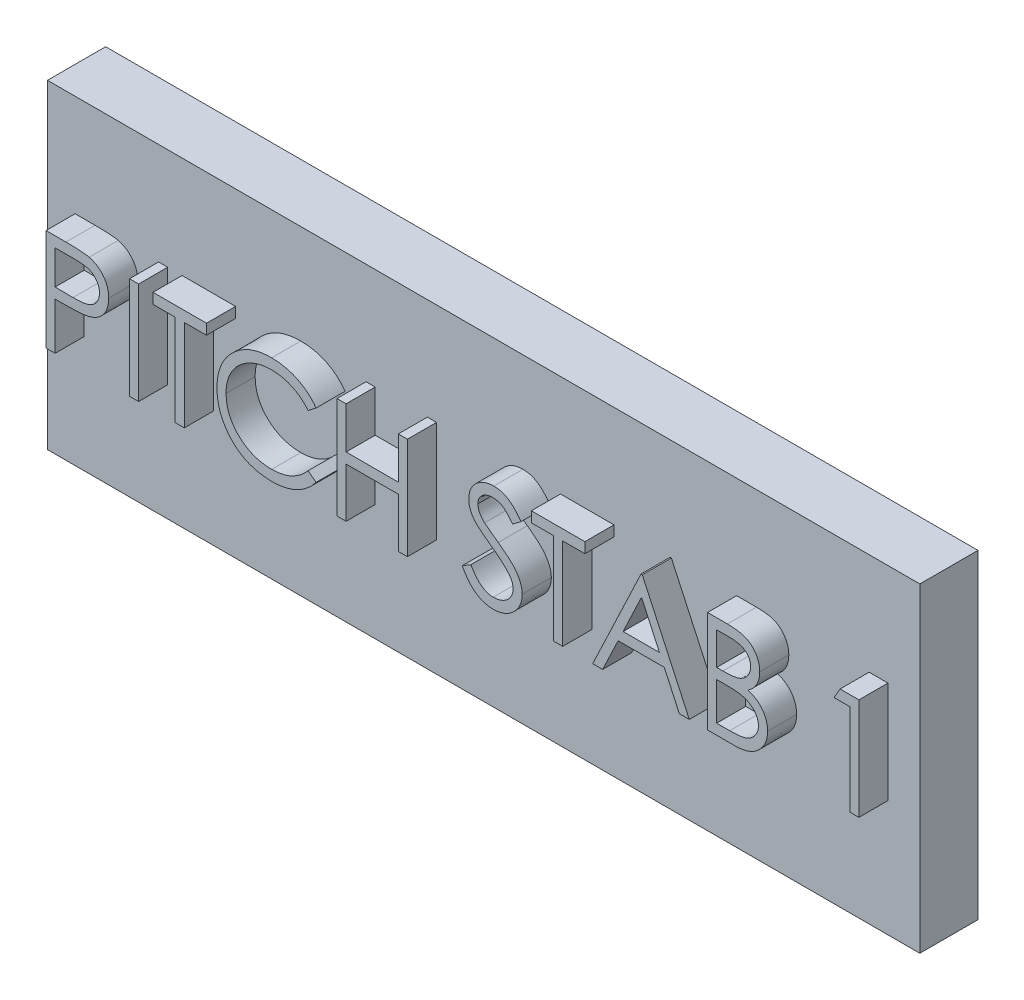
from build123d import *

# Parameters (mm, degrees)
SKETCH1_W           = 30
SKETCH1_H           = 11
BOSS_EXTRUDE1_DEPTH = 2
SKETCH2_W           = 0.314102564
SKETCH2_H           = 3.5
BOSS_EXTRUDE2_DEPTH = 1


with BuildPart() as part:
    # Sketch1 → Boss-Extrude1 (new body)
    with BuildSketch(Plane.XY):
        with Locations((-36.24, 26.08)):
            Rectangle(SKETCH1_W, SKETCH1_H)
    extrude(amount=BOSS_EXTRUDE1_DEPTH)

    # Sketch2 → Boss-Extrude2 (add)
    # profile 1 of 10: a face of its own
    with BuildSketch(Plane.XY.offset(2)):
        with BuildLine():
            Line((-50.291282051, 28.08), (-49.604883814, 28.08))
            add(Edge.make_bspline(
                [(-49.604883814, 28.08), (-49.557672908, 28.079948104), (-49.467214715, 28.079848668), (-49.337499659, 28.076833922), (-49.219689928, 28.07280723), (-49.114039547, 28.067225337), (-49.020223449, 28.060628747), (-48.938666149, 28.051376708), (-48.868726593, 28.041716412), (-48.826820143, 28.031895005), (-48.807708333, 28.027415865)],
                knots=[0, 0, 0, 0, 1.415646017, 2.712440637, 3.8905458, 4.950247383, 5.884950622, 6.709939814, 7.411656543, 8, 8, 8, 8], degree=3))
            add(Edge.make_bspline(
                [(-48.807708333, 28.027415865), (-48.7835148, 28.020793916), (-48.735697822, 28.007706054), (-48.666796779, 27.98149233), (-48.601242934, 27.950410165), (-48.538811375, 27.914986225), (-48.480269292, 27.873700661), (-48.424743251, 27.828227043), (-48.372723271, 27.777515475), (-48.324501879, 27.722134735), (-48.280217082, 27.663014525), (-48.242087399, 27.599272295), (-48.210160172, 27.531980992), (-48.1827769, 27.461187421), (-48.163068446, 27.386297097), (-48.148221546, 27.307830385), (-48.138797918, 27.225795695), (-48.137895357, 27.169735827), (-48.137435897, 27.141197917)],
                knots=[0, 0, 0, 0, 0.999701418, 1.975846123, 2.934577507, 3.890451536, 4.834027766, 5.787354733, 6.749476667, 7.726910423, 8.712836071, 9.690891519, 10.682875813, 11.679750201, 12.712814741, 13.765529915, 14.8625177, 16, 16, 16, 16], degree=3))
            add(Edge.make_bspline(
                [(-48.137435897, 27.141197917), (-48.137857322, 27.11242014), (-48.138681868, 27.056114476), (-48.148578153, 26.973741688), (-48.161908345, 26.895023298), (-48.182405397, 26.820133847), (-48.20925107, 26.749518077), (-48.240743123, 26.682096845), (-48.278726654, 26.619017173), (-48.322371483, 26.560050055), (-48.370923078, 26.505140143), (-48.424176016, 26.454685348), (-48.481915308, 26.40898101), (-48.543957457, 26.367924666), (-48.610907305, 26.332468387), (-48.681749459, 26.300711082), (-48.757099675, 26.274040021), (-48.809242189, 26.26000996), (-48.835753205, 26.252876603)],
                knots=[0, 0, 0, 0, 1.121902311, 2.195077645, 3.232258892, 4.234102512, 5.217864754, 6.176164875, 7.132989551, 8.084763148, 9.034132444, 9.988522005, 10.94243251, 11.903244335, 12.886203696, 13.894208494, 14.929344452, 16, 16, 16, 16], degree=3))
            add(Edge.make_bspline(
                [(-48.835753205, 26.252876603), (-48.857680539, 26.248213621), (-48.905735566, 26.237994427), (-48.984878289, 26.22658597), (-49.077023675, 26.21684837), (-49.182045955, 26.209547232), (-49.299850859, 26.203296864), (-49.430502117, 26.19832877), (-49.574256194, 26.195598916), (-49.674527438, 26.195458123), (-49.726879006, 26.195384615)],
                knots=[0, 0, 0, 0, 0.601384939, 1.31797006, 2.144135048, 3.087295005, 4.142315834, 5.309527816, 6.595305764, 8, 8, 8, 8], degree=3))
            Line((-49.726879006, 26.195384615), (-49.977179487, 26.195384615))
            Line((-49.977179487, 26.195384615), (-49.977179487, 24.58))
            Line((-49.977179487, 24.58), (-50.291282051, 24.58))
            Line((-50.291282051, 24.58), (-50.291282051, 28.08))
        make_face()
        with BuildLine():
            Line((-49.977179487, 27.721025641), (-49.977179487, 26.554358974))
            Line((-49.977179487, 26.554358974), (-49.364399038, 26.546646635))
            add(Edge.make_bspline(
                [(-49.364399038, 26.546646635), (-49.334479113, 26.546631171), (-49.276719313, 26.546601319), (-49.193283089, 26.550586542), (-49.115873802, 26.555187075), (-49.044729227, 26.561922998), (-48.979817292, 26.571444256), (-48.921029763, 26.581055994), (-48.868822481, 26.594961356), (-48.807723279, 26.613684426), (-48.739639931, 26.645617041), (-48.665572383, 26.691966931), (-48.602801796, 26.75104764), (-48.5484835, 26.817475471), (-48.505377622, 26.8913746), (-48.473821629, 26.970443537), (-48.455280472, 27.053871387), (-48.452794278, 27.110959525), (-48.451538462, 27.139795673)],
                knots=[0, 0, 0, 0, 1.160613943, 2.240541288, 3.23993089, 4.169200891, 5.011653406, 5.7853311, 6.478053781, 7.106038997, 8.262395093, 9.384106736, 10.481365981, 11.59014053, 12.70357646, 13.786202915, 14.881775077, 16, 16, 16, 16], degree=3))
            add(Edge.make_bspline(
                [(-48.451538462, 27.139795673), (-48.452801108, 27.167934187), (-48.455311093, 27.223870069), (-48.473966956, 27.305848829), (-48.50531627, 27.384084534), (-48.548772865, 27.457057619), (-48.601513994, 27.523246423), (-48.662813338, 27.58074355), (-48.732526599, 27.626965253), (-48.79737483, 27.656798534), (-48.854976016, 27.67501381), (-48.905007976, 27.68775865), (-48.96149865, 27.697934257), (-49.02446643, 27.706173759), (-49.093423264, 27.713227221), (-49.168961579, 27.718013198), (-49.250795222, 27.720814654), (-49.307605793, 27.720953609), (-49.337055288, 27.721025641)],
                knots=[0, 0, 0, 0, 1.120700087, 2.227813068, 3.331159281, 4.466773991, 5.599788987, 6.693661531, 7.80175334, 8.91857717, 9.525282508, 10.207424825, 10.974604443, 11.810962634, 12.737642355, 13.736264703, 14.826523623, 16, 16, 16, 16], degree=3))
            Line((-49.337055288, 27.721025641), (-49.977179487, 27.721025641))
        make_face(mode=Mode.SUBTRACT)
    # profile 2 of 10: a face of its own
    with BuildSketch(Plane.XY.offset(2)):
        with Locations((-47.262435897, 26.33)):
            Rectangle(SKETCH2_W, SKETCH2_H)
    # profile 3 of 10: a face of its own
    with BuildSketch(Plane.XY.offset(2)):
        Polygon((-46.611794872, 27.721025641), (-46.611794872, 28.08), (-44.772051282, 28.08), (-44.772051282, 27.721025641), (-45.534871795, 27.721025641), (-45.534871795, 24.58), (-45.848974359, 24.58), (-45.848974359, 27.721025641), align=None)
    # profile 4 of 10: a face of its own
    with BuildSketch(Plane.XY.offset(2)):
        with BuildLine():
            Line((-41.002820513, 27.437772436), (-41.277660256, 27.227435897))
            add(Edge.make_bspline(
                [(-41.277660256, 27.227435897), (-41.297266145, 27.250801867), (-41.336213592, 27.297218783), (-41.398872794, 27.362398327), (-41.464174437, 27.423463589), (-41.532093558, 27.480705469), (-41.603852678, 27.532122234), (-41.677713476, 27.580393337), (-41.754911522, 27.623661075), (-41.861663256, 27.676124061), (-42.001311105, 27.730870216), (-42.177105944, 27.776773448), (-42.360617042, 27.805994623), (-42.485814642, 27.809159465), (-42.549495192, 27.810769231)],
                knots=[0, 0, 0, 0, 0.757959112, 1.505699292, 2.245454638, 2.979532153, 3.711538275, 4.438200793, 5.171680507, 5.909471876, 7.393775596, 8.890124382, 10.418191784, 12, 12, 12, 12], degree=3))
            add(Edge.make_bspline(
                [(-42.549495192, 27.810769231), (-42.584578492, 27.810365268), (-42.654419484, 27.809561092), (-42.758067958, 27.798951967), (-42.859781009, 27.784040757), (-42.959492475, 27.761915434), (-43.057075434, 27.733942815), (-43.153167836, 27.700517401), (-43.246378435, 27.659162561), (-43.337996674, 27.613454301), (-43.425775885, 27.561826856), (-43.508830932, 27.505513504), (-43.5868589, 27.445144408), (-43.659921513, 27.380493302), (-43.728093461, 27.311851341), (-43.790880772, 27.238487), (-43.848066182, 27.160634826), (-43.900783207, 27.079321419), (-43.94799594, 26.994783627), (-43.98752582, 26.906708556), (-44.022530942, 26.816604453), (-44.050230185, 26.723453293), (-44.072154701, 26.627910527), (-44.087282365, 26.529719739), (-44.097770836, 26.429086059), (-44.098571013, 26.360876747), (-44.098974359, 26.326494391)],
                knots=[0, 0, 0, 0, 1.054917814, 2.100044995, 3.131103042, 4.146048494, 5.169673617, 6.183595914, 7.203665975, 8.234915748, 9.262203917, 10.264457458, 11.251630812, 12.227803204, 13.197192746, 14.159520551, 15.12972552, 16.100847026, 17.073214652, 18.039054194, 19.002613845, 19.979014051, 20.95965708, 21.949030935, 22.966165397, 24, 24, 24, 24], degree=3))
            add(Edge.make_bspline(
                [(-44.098974359, 26.326494391), (-44.09771254, 26.274763071), (-44.095235126, 26.173195486), (-44.073186792, 26.024424876), (-44.0396817, 25.881904202), (-43.989466123, 25.74652436), (-43.927547073, 25.616616002), (-43.849306461, 25.494377148), (-43.758689924, 25.377960584), (-43.654415504, 25.270117636), (-43.540009688, 25.171603911), (-43.417261777, 25.084853329), (-43.286477489, 25.012538447), (-43.149100859, 24.9523625), (-43.004074745, 24.906105772), (-42.851659943, 24.873541649), (-42.692187947, 24.852299468), (-42.583218547, 24.85026578), (-42.527760417, 24.849230769)],
                knots=[0, 0, 0, 0, 1.029171465, 2.020641659, 2.987623507, 3.938342917, 4.889210282, 5.84687017, 6.821220943, 7.821438502, 8.827599549, 9.822697543, 10.807740252, 11.797342354, 12.80366471, 13.83203677, 14.896651826, 16, 16, 16, 16], degree=3))
            add(Edge.make_bspline(
                [(-42.527760417, 24.849230769), (-42.466657728, 24.850919549), (-42.346393019, 24.854243472), (-42.170024992, 24.882402721), (-42.001189227, 24.928060638), (-41.83987664, 24.991958561), (-41.686541994, 25.075023849), (-41.540945334, 25.175721726), (-41.402963763, 25.295010059), (-41.319992481, 25.386093187), (-41.277660256, 25.432564103)],
                knots=[0, 0, 0, 0, 1.028121516, 2.023589091, 2.998037872, 3.967518031, 4.937445131, 5.927275754, 6.942489185, 8, 8, 8, 8], degree=3))
            Line((-41.277660256, 25.432564103), (-41.002820513, 25.224330929))
            add(Edge.make_bspline(
                [(-41.002820513, 25.224330929), (-41.024938623, 25.195792478), (-41.069068898, 25.138852271), (-41.140526915, 25.058580562), (-41.215804212, 24.983076526), (-41.295459922, 24.912948905), (-41.378577714, 24.846794439), (-41.466650026, 24.786492608), (-41.558519059, 24.731201724), (-41.653873538, 24.680574799), (-41.752612151, 24.635657552), (-41.854616585, 24.597203784), (-41.959447161, 24.564078895), (-42.067108669, 24.536826958), (-42.177824426, 24.515555874), (-42.2911949, 24.501336199), (-42.407464775, 24.491594285), (-42.485906197, 24.490706369), (-42.525657051, 24.49025641)],
                knots=[0, 0, 0, 0, 0.986787822, 1.968848986, 2.935600012, 3.899624008, 4.868462664, 5.837806735, 6.815139263, 7.798259679, 8.787526145, 9.778297419, 10.776456485, 11.791383307, 12.812564526, 13.85620153, 14.913611965, 16, 16, 16, 16], degree=3))
            add(Edge.make_bspline(
                [(-42.525657051, 24.49025641), (-42.563300718, 24.490518403), (-42.637736408, 24.491036461), (-42.74763516, 24.499428628), (-42.854624741, 24.510878365), (-42.958399367, 24.528118496), (-43.059525342, 24.548462836), (-43.157085926, 24.575734093), (-43.252041137, 24.606283259), (-43.344009477, 24.642188246), (-43.433069177, 24.682704429), (-43.518932988, 24.728495987), (-43.601561421, 24.779177852), (-43.681766842, 24.833632863), (-43.758364425, 24.893610164), (-43.832017951, 24.958276799), (-43.903140427, 25.02741481), (-43.947143112, 25.077269663), (-43.969266827, 25.102335737)],
                knots=[0, 0, 0, 0, 1.114604814, 2.203992996, 3.262667896, 4.300477797, 5.318619304, 6.316056647, 7.298880507, 8.271930387, 9.238335007, 10.195173496, 11.151986948, 12.108099108, 13.064862484, 14.031167946, 15.010108607, 16, 16, 16, 16], degree=3))
            add(Edge.make_bspline(
                [(-43.969266827, 25.102335737), (-44.00470247, 25.145876926), (-44.075145947, 25.232433637), (-44.165271631, 25.372719618), (-44.242419186, 25.519187827), (-44.304795107, 25.672607755), (-44.35355784, 25.832635143), (-44.387339035, 25.999350657), (-44.40929064, 26.172598599), (-44.411800928, 26.290435388), (-44.413076923, 26.350332532)],
                knots=[0, 0, 0, 0, 0.994628077, 1.977248131, 2.950237994, 3.925870899, 4.908910175, 5.911660606, 6.938484602, 8, 8, 8, 8], degree=3))
            add(Edge.make_bspline(
                [(-44.413076923, 26.350332532), (-44.41152173, 26.413287986), (-44.408461983, 26.53714891), (-44.382466188, 26.718922863), (-44.340647392, 26.893074262), (-44.281250503, 27.059278007), (-44.205945152, 27.218408287), (-44.112918538, 27.369249492), (-44.003251396, 27.512766292), (-43.877803828, 27.646781043), (-43.740236493, 27.769320396), (-43.592917679, 27.877126599), (-43.436135732, 27.966844115), (-43.27161788, 28.041840278), (-43.098132199, 28.099484741), (-42.916048829, 28.139837928), (-42.725709915, 28.164955044), (-42.595847489, 28.168130252), (-42.529863782, 28.16974359)],
                knots=[0, 0, 0, 0, 1.032925535, 2.032216505, 3.007276963, 3.968222605, 4.92396291, 5.891752235, 6.871517503, 7.883894988, 8.900124299, 9.891468569, 10.874487609, 11.85992873, 12.854644235, 13.869047385, 14.917252991, 16, 16, 16, 16], degree=3))
            add(Edge.make_bspline(
                [(-42.529863782, 28.16974359), (-42.48964931, 28.169261452), (-42.410048813, 28.168307108), (-42.29229616, 28.159000965), (-42.177653833, 28.143487359), (-42.066042851, 28.122371289), (-41.956920235, 28.096163968), (-41.851119994, 28.06202367), (-41.748021307, 28.022987138), (-41.648274399, 27.978028672), (-41.552357849, 27.927561931), (-41.460301531, 27.872146307), (-41.372836672, 27.811850502), (-41.289347824, 27.747187326), (-41.211231612, 27.676788767), (-41.136270134, 27.602591171), (-41.067009056, 27.522457347), (-41.024255861, 27.466052413), (-41.002820513, 27.437772436)],
                knots=[0, 0, 0, 0, 1.096760587, 2.17092713, 3.219439832, 4.250915756, 5.268269357, 6.278326846, 7.281116186, 8.274029601, 9.260640565, 10.235837813, 11.203064059, 12.156899882, 13.114053108, 14.069676657, 15.032185724, 16, 16, 16, 16], degree=3))
        make_face()
    # profile 5 of 10: a face of its own
    with BuildSketch(Plane.XY.offset(2)):
        Polygon((-40.284871795, 28.08), (-39.970769231, 28.08), (-39.970769231, 26.644102564), (-38.175897436, 26.644102564), (-38.175897436, 28.08), (-37.861794872, 28.08), (-37.861794872, 24.58), (-38.175897436, 24.58), (-38.175897436, 26.285128205), (-39.970769231, 26.285128205), (-39.970769231, 24.58), (-40.284871795, 24.58), align=None)
    # profile 6 of 10: a face of its own
    with BuildSketch(Plane.XY.offset(2)):
        with BuildLine():
            Line((-35.977179487, 25.255180288), (-35.68130609, 25.432564103))
            add(Edge.make_bspline(
                [(-35.68130609, 25.432564103), (-35.653787852, 25.386499718), (-35.601063972, 25.298242134), (-35.513112613, 25.178984093), (-35.421979702, 25.077621937), (-35.326990368, 24.994745329), (-35.22872442, 24.929496442), (-35.126540366, 24.883294211), (-35.020782555, 24.854478235), (-34.948808734, 24.850978149), (-34.912876603, 24.849230769)],
                knots=[0, 0, 0, 0, 1.272034388, 2.437168799, 3.508375237, 4.49857839, 5.41946034, 6.295179144, 7.148887113, 8, 8, 8, 8], degree=3))
            add(Edge.make_bspline(
                [(-34.912876603, 24.849230769), (-34.882189742, 24.850085442), (-34.821352969, 24.851779832), (-34.731790726, 24.868060634), (-34.644808924, 24.893072763), (-34.562200286, 24.928893694), (-34.485104672, 24.97223218), (-34.417497976, 25.024578358), (-34.359051863, 25.083184563), (-34.311242748, 25.148567218), (-34.274562713, 25.218884367), (-34.246370645, 25.291060318), (-34.230725571, 25.366228886), (-34.228368818, 25.416839349), (-34.227179487, 25.442379808)],
                knots=[0, 0, 0, 0, 1.095163259, 2.171163733, 3.241058638, 4.321873601, 5.38011039, 6.391990106, 7.366004449, 8.327778327, 9.272591725, 10.192022065, 11.087607919, 12, 12, 12, 12], degree=3))
            add(Edge.make_bspline(
                [(-34.227179487, 25.442379808), (-34.228653798, 25.471520657), (-34.231650856, 25.530759747), (-34.256982336, 25.6181594), (-34.296831583, 25.70465197), (-34.333594227, 25.758153235), (-34.352680288, 25.785929487)],
                knots=[0, 0, 0, 0, 0.938893495, 1.908633276, 2.914225137, 4, 4, 4, 4], degree=3))
            add(Edge.make_bspline(
                [(-34.352680288, 25.785929487), (-34.368350903, 25.805976311), (-34.401249397, 25.848062109), (-34.45780691, 25.910707345), (-34.524173024, 25.975325764), (-34.598076579, 26.044384821), (-34.682209668, 26.114672617), (-34.773937182, 26.189540895), (-34.875601041, 26.266142472), (-34.946900538, 26.317515038), (-34.983689904, 26.344022436)],
                knots=[0, 0, 0, 0, 0.722233717, 1.516239348, 2.393582979, 3.351407094, 4.387010283, 5.505090956, 6.712668013, 8, 8, 8, 8], degree=3))
            add(Edge.make_bspline(
                [(-34.983689904, 26.344022436), (-35.0205139, 26.370251024), (-35.090918577, 26.420398086), (-35.189377159, 26.49482237), (-35.277421622, 26.562866239), (-35.354660638, 26.625170251), (-35.421060235, 26.681742856), (-35.477143646, 26.732040795), (-35.521482203, 26.777424356), (-35.546137784, 26.806865698), (-35.557207532, 26.820084135)],
                knots=[0, 0, 0, 0, 1.452282411, 2.77665338, 3.964542531, 5.026858415, 5.96415736, 6.766646006, 7.446254459, 8, 8, 8, 8], degree=3))
            add(Edge.make_bspline(
                [(-35.557207532, 26.820084135), (-35.572680077, 26.840685171), (-35.603108914, 26.881199875), (-35.643274919, 26.944524733), (-35.677414082, 27.009347998), (-35.704176414, 27.075843863), (-35.726712633, 27.143078792), (-35.741870564, 27.211930038), (-35.751361961, 27.282088656), (-35.752333947, 27.329302157), (-35.752820513, 27.352936699)],
                knots=[0, 0, 0, 0, 1.068054152, 2.10047183, 3.106115577, 4.101338837, 5.06977816, 6.043150881, 7.020423561, 8, 8, 8, 8], degree=3))
            add(Edge.make_bspline(
                [(-35.752820513, 27.352936699), (-35.751515304, 27.389966473), (-35.748932784, 27.463234537), (-35.727092266, 27.570265367), (-35.692619373, 27.672451785), (-35.644324485, 27.768782118), (-35.582067132, 27.856748099), (-35.510021158, 27.937361586), (-35.424209671, 28.005130168), (-35.330057048, 28.064342227), (-35.227000676, 28.110688152), (-35.119009773, 28.145649132), (-35.005912701, 28.16545839), (-34.929309566, 28.168301155), (-34.890440705, 28.16974359)],
                knots=[0, 0, 0, 0, 1.005424448, 1.989358655, 2.955360095, 3.929531133, 4.905563448, 5.876582895, 6.856512386, 7.866279853, 8.892233794, 9.918561126, 10.94386622, 12, 12, 12, 12], degree=3))
            add(Edge.make_bspline(
                [(-34.890440705, 28.16974359), (-34.849196605, 28.168321038), (-34.767175253, 28.165492037), (-34.646526038, 28.140894506), (-34.530365321, 28.100193834), (-34.436922056, 28.054005176), (-34.363789295, 28.00787376), (-34.308016562, 27.965853936), (-34.251499111, 27.917478827), (-34.193781057, 27.862619581), (-34.135840397, 27.80077283), (-34.076816945, 27.732362141), (-34.016572676, 27.657805585), (-33.977816816, 27.604581085), (-33.957948718, 27.577295673)],
                knots=[0, 0, 0, 0, 1.286793592, 2.559021753, 3.825965368, 5.121522368, 5.803751409, 6.523245864, 7.299691795, 8.125521123, 9.008227632, 9.944561021, 10.946284179, 12, 12, 12, 12], degree=3))
            Line((-33.957948718, 27.577295673), (-34.241903045, 27.362051282))
            add(Edge.make_bspline(
                [(-34.241903045, 27.362051282), (-34.259048977, 27.384139972), (-34.292068034, 27.426677626), (-34.342197521, 27.486248941), (-34.389446169, 27.540665421), (-34.435996569, 27.587930549), (-34.4793902, 27.630632682), (-34.521507243, 27.667192439), (-34.561741594, 27.697968034), (-34.612458505, 27.730811594), (-34.676176223, 27.763368098), (-34.756160759, 27.790917176), (-34.839747034, 27.807472238), (-34.896676666, 27.809661126), (-34.925496795, 27.810769231)],
                knots=[0, 0, 0, 0, 1.181633172, 2.275549214, 3.290209073, 4.226197932, 5.078386478, 5.862611352, 6.581680152, 7.217281963, 8.414376989, 9.595101626, 10.782541182, 12, 12, 12, 12], degree=3))
            add(Edge.make_bspline(
                [(-34.925496795, 27.810769231), (-34.961653317, 27.809557531), (-35.031377765, 27.807220882), (-35.130368001, 27.781700896), (-35.219461926, 27.741519036), (-35.296014491, 27.685204058), (-35.359751468, 27.618483065), (-35.405856927, 27.54170421), (-35.433607091, 27.456921808), (-35.436993371, 27.397780151), (-35.438717949, 27.367660256)],
                knots=[0, 0, 0, 0, 1.14458467, 2.207223713, 3.21896685, 4.227309161, 5.202851033, 6.127160689, 7.046193047, 8, 8, 8, 8], degree=3))
            add(Edge.make_bspline(
                [(-35.438717949, 27.367660256), (-35.438324822, 27.348908778), (-35.437537926, 27.311375158), (-35.426563128, 27.255923736), (-35.412463799, 27.200612397), (-35.390121168, 27.145689814), (-35.359275864, 27.090195455), (-35.318770688, 27.033173718), (-35.267757376, 26.974122009), (-35.228680364, 26.935714635), (-35.208048878, 26.915436699)],
                knots=[0, 0, 0, 0, 0.858281714, 1.717966888, 2.583508476, 3.4729293, 4.427298488, 5.488583878, 6.674047936, 8, 8, 8, 8], degree=3))
            add(Edge.make_bspline(
                [(-35.208048878, 26.915436699), (-35.200387506, 26.908599673), (-35.182185839, 26.892356465), (-35.148909913, 26.865764184), (-35.104967115, 26.832961412), (-35.051504914, 26.792374095), (-34.987537552, 26.745292633), (-34.913057996, 26.692319021), (-34.828896463, 26.631733562), (-34.769174547, 26.589376021), (-34.737596154, 26.566979167)],
                knots=[0, 0, 0, 0, 0.420754252, 0.999615792, 1.744751191, 2.668019286, 3.750313428, 4.999500688, 6.413464383, 8, 8, 8, 8], degree=3))
            add(Edge.make_bspline(
                [(-34.737596154, 26.566979167), (-34.699610241, 26.539337807), (-34.626055784, 26.485814145), (-34.521398204, 26.405398465), (-34.426504396, 26.326750697), (-34.341041193, 26.25037309), (-34.264164284, 26.176844997), (-34.196726563, 26.105281816), (-34.138040883, 26.036196244), (-34.074861665, 25.947623668), (-34.010303845, 25.838842584), (-33.954862338, 25.705564345), (-33.91990399, 25.571768025), (-33.915332475, 25.481841188), (-33.913076923, 25.437471955)],
                knots=[0, 0, 0, 0, 1.163667725, 2.253281268, 3.268753668, 4.215851969, 5.092017293, 5.902905408, 6.650798638, 7.335211899, 8.59617414, 9.77448103, 10.901945474, 12, 12, 12, 12], degree=3))
            add(Edge.make_bspline(
                [(-33.913076923, 25.437471955), (-33.913734061, 25.40609359), (-33.915035576, 25.343946206), (-33.92999649, 25.25269113), (-33.951916155, 25.16406026), (-33.984953389, 25.079149147), (-34.025276547, 24.996404385), (-34.076442795, 24.917996484), (-34.13575048, 24.842190086), (-34.203784245, 24.771006594), (-34.278230147, 24.705660398), (-34.356913842, 24.647531337), (-34.439964115, 24.599063014), (-34.526930432, 24.559512172), (-34.617832768, 24.528578654), (-34.712640552, 24.506165785), (-34.811510063, 24.492410074), (-34.878710545, 24.490982313), (-34.912876603, 24.49025641)],
                knots=[0, 0, 0, 0, 0.983748083, 1.948392443, 2.894712957, 3.844097841, 4.80183111, 5.778335162, 6.776009319, 7.81870978, 8.863265674, 9.881300176, 10.883814829, 11.87499822, 12.874611388, 13.892143829, 14.928324115, 16, 16, 16, 16], degree=3))
            add(Edge.make_bspline(
                [(-34.912876603, 24.49025641), (-34.939311946, 24.490767592), (-34.991849706, 24.491783517), (-35.069559187, 24.500764798), (-35.145698777, 24.513471901), (-35.219313059, 24.533645971), (-35.29135047, 24.558122948), (-35.361497705, 24.588261281), (-35.429788759, 24.624378482), (-35.496606342, 24.665673507), (-35.561780516, 24.713731252), (-35.624699984, 24.769704748), (-35.68742917, 24.832050253), (-35.748116566, 24.902460816), (-35.80798971, 24.979798899), (-35.86586812, 25.064788083), (-35.922949837, 25.156965436), (-35.958765305, 25.221830522), (-35.977179487, 25.255180288)],
                knots=[0, 0, 0, 0, 0.915332311, 1.819136955, 2.706846663, 3.586547465, 4.459518054, 5.340707479, 6.227863349, 7.133153174, 8.059268498, 9.028702269, 10.047606654, 11.120612155, 12.245963614, 13.433783089, 14.680604001, 16, 16, 16, 16], degree=3))
        make_face()
    # profile 7 of 10: a face of its own
    with BuildSketch(Plane.XY.offset(2)):
        Polygon((-33.598974359, 27.721025641), (-33.598974359, 28.08), (-31.759230769, 28.08), (-31.759230769, 27.721025641), (-32.522051282, 27.721025641), (-32.522051282, 24.58), (-32.836153846, 24.58), (-32.836153846, 27.721025641), align=None)
    # profile 8 of 10: a face of its own
    with BuildSketch(Plane.XY.offset(2)):
        Polygon((-29.784871795, 28.08), (-28.169487179, 24.58), (-28.510933494, 24.58), (-29.028361378, 25.701794872), (-30.615, 25.701794872), (-31.147151442, 24.58), (-31.49, 24.58), (-29.82974359, 28.08), align=None)
        Polygon((-29.810813301, 27.397808494), (-30.444627404, 26.060769231), (-29.193826122, 26.060769231), align=None, mode=Mode.SUBTRACT)
    # profile 9 of 10: a face of its own
    with BuildSketch(Plane.XY.offset(2)):
        with BuildLine():
            Line((-27.541282051, 28.08), (-26.858389423, 28.08))
            add(Edge.make_bspline(
                [(-26.858389423, 28.08), (-26.824960945, 28.07982425), (-26.760168235, 28.079483602), (-26.665948793, 28.07420047), (-26.577699982, 28.066996801), (-26.49539621, 28.055566708), (-26.419075507, 28.041774931), (-26.34850787, 28.025073115), (-26.283917698, 28.005046501), (-26.206804961, 27.97320022), (-26.118884301, 27.925877051), (-26.023685908, 27.855948486), (-25.942281668, 27.770416023), (-25.872095351, 27.673933368), (-25.816294232, 27.567797596), (-25.775924934, 27.454538407), (-25.750367059, 27.335616665), (-25.747738625, 27.253973487), (-25.746410256, 27.21271234)],
                knots=[0, 0, 0, 0, 1.001505555, 1.941167018, 2.826882275, 3.653841531, 4.429895133, 5.150066043, 5.825578002, 6.45369114, 7.647487171, 8.808567382, 9.977351308, 11.170798116, 12.373658725, 13.556498008, 14.765093433, 16, 16, 16, 16], degree=3))
            add(Edge.make_bspline(
                [(-25.746410256, 27.21271234), (-25.747503475, 27.174059784), (-25.749651752, 27.098103867), (-25.770194512, 26.987009758), (-25.80235518, 26.881258539), (-25.847060429, 26.781236154), (-25.905162425, 26.68920254), (-25.974020744, 26.604415274), (-26.057097546, 26.530464217), (-26.119340786, 26.489121315), (-26.150957532, 26.468120994)],
                knots=[0, 0, 0, 0, 1.044552857, 2.05264487, 3.044412934, 4.028983338, 5.005914585, 5.980388656, 6.974128949, 8, 8, 8, 8], degree=3))
            add(Edge.make_bspline(
                [(-26.150957532, 26.468120994), (-26.111197104, 26.452855995), (-26.035125557, 26.42365027), (-25.930439545, 26.372014806), (-25.8402447, 26.315852696), (-25.763847554, 26.254520846), (-25.698509899, 26.188412035), (-25.641456957, 26.116556921), (-25.592775583, 26.038018163), (-25.551062659, 25.953614627), (-25.518513903, 25.864208159), (-25.494137999, 25.770637383), (-25.48017055, 25.673237828), (-25.478182909, 25.606952448), (-25.477179487, 25.573489583)],
                knots=[0, 0, 0, 0, 1.27268992, 2.434971085, 3.483601985, 4.442670788, 5.356604649, 6.2567628, 7.179492994, 8.113709626, 9.066344395, 10.018646069, 10.999752585, 12, 12, 12, 12], degree=3))
            add(Edge.make_bspline(
                [(-25.477179487, 25.573489583), (-25.478156333, 25.539322711), (-25.480078305, 25.472098433), (-25.494258277, 25.373343299), (-25.518267384, 25.278968352), (-25.55133853, 25.188363169), (-25.594500845, 25.101703035), (-25.647028809, 25.018889771), (-25.709660373, 24.94075544), (-25.779723242, 24.866431817), (-25.858985387, 24.79960403), (-25.944501142, 24.740088323), (-26.037347462, 24.691142261), (-26.135999456, 24.650026239), (-26.241563772, 24.618619041), (-26.35356638, 24.596646467), (-26.471910681, 24.58184143), (-26.553120433, 24.580624225), (-26.594767628, 24.58)],
                knots=[0, 0, 0, 0, 0.978564426, 1.925352924, 2.850884081, 3.763762016, 4.682927383, 5.618979971, 6.567305752, 7.547517671, 8.540179244, 9.531824382, 10.526200242, 11.540722885, 12.589160233, 13.674978461, 14.80764778, 16, 16, 16, 16], degree=3))
            Line((-26.594767628, 24.58), (-27.541282051, 24.58))
            Line((-27.541282051, 24.58), (-27.541282051, 28.08))
        make_face()
        with BuildLine():
            Line((-27.227179487, 27.721025641), (-27.227179487, 26.599230769))
            Line((-27.227179487, 26.599230769), (-27.016141827, 26.599230769))
            add(Edge.make_bspline(
                [(-27.016141827, 26.599230769), (-26.985293032, 26.599630692), (-26.925686872, 26.600403425), (-26.839366976, 26.602616942), (-26.759241958, 26.608814985), (-26.685450124, 26.615011248), (-26.618107681, 26.625085835), (-26.557363819, 26.637077958), (-26.502265222, 26.649760863), (-26.438725677, 26.67133035), (-26.366652728, 26.703208025), (-26.289819624, 26.752679861), (-26.222085154, 26.811604215), (-26.164887967, 26.879595176), (-26.118076496, 26.954461362), (-26.085562781, 27.035008243), (-26.063515497, 27.119228375), (-26.061523965, 27.177046627), (-26.060512821, 27.206402244)],
                knots=[0, 0, 0, 0, 1.156816544, 2.235205308, 3.236616184, 4.169592532, 5.011045266, 5.787822928, 6.49130361, 7.128639758, 8.301311294, 9.436451833, 10.541879658, 11.654887649, 12.756523258, 13.837046038, 14.901820046, 16, 16, 16, 16], degree=3))
            add(Edge.make_bspline(
                [(-26.060512821, 27.206402244), (-26.061039001, 27.225828015), (-26.062071161, 27.263933787), (-26.070524463, 27.319483141), (-26.084892038, 27.371726894), (-26.103346331, 27.421381004), (-26.12913502, 27.466892854), (-26.159498483, 27.50983605), (-26.196184173, 27.548748169), (-26.237941486, 27.585117667), (-26.285950109, 27.617362195), (-26.340181401, 27.645602958), (-26.401369078, 27.668343735), (-26.468481933, 27.688259887), (-26.54255302, 27.702248181), (-26.622727573, 27.713901569), (-26.709662292, 27.719834311), (-26.769807395, 27.720619673), (-26.800897436, 27.721025641)],
                knots=[0, 0, 0, 0, 0.91205012, 1.789085906, 2.630437955, 3.453916878, 4.269457761, 5.079663411, 5.91843418, 6.774407191, 7.675494373, 8.627863946, 9.638891023, 10.736472738, 11.911756761, 13.175263542, 14.539845004, 16, 16, 16, 16], degree=3))
            Line((-26.800897436, 27.721025641), (-27.227179487, 27.721025641))
        make_face(mode=Mode.SUBTRACT)
        with BuildLine():
            Line((-27.227179487, 26.24025641), (-27.227179487, 24.938974359))
            Line((-27.227179487, 24.938974359), (-26.779863782, 24.938974359))
            add(Edge.make_bspline(
                [(-26.779863782, 24.938974359), (-26.747844856, 24.939358106), (-26.686132598, 24.940097729), (-26.597031367, 24.942512283), (-26.514448264, 24.948004559), (-26.438760128, 24.956650409), (-26.369149675, 24.966028858), (-26.306451972, 24.978640139), (-26.250158779, 24.993089099), (-26.184884471, 25.015423272), (-26.111380963, 25.050119743), (-26.032170106, 25.102433969), (-25.961743888, 25.164757277), (-25.901938629, 25.236888191), (-25.85292564, 25.315319518), (-25.817270185, 25.398464868), (-25.795279329, 25.484950395), (-25.792617159, 25.543917108), (-25.791282051, 25.573489583)],
                knots=[0, 0, 0, 0, 1.160039823, 2.235823828, 3.228722157, 4.157150951, 4.99529583, 5.772374946, 6.472645482, 7.099169577, 8.269452708, 9.405989375, 10.527446681, 11.663510218, 12.788923519, 13.866172445, 14.929861265, 16, 16, 16, 16], degree=3))
            add(Edge.make_bspline(
                [(-25.791282051, 25.573489583), (-25.791558156, 25.591982924), (-25.792105911, 25.628671306), (-25.800366526, 25.682587125), (-25.812380395, 25.734812998), (-25.827911829, 25.785490739), (-25.850531296, 25.833704115), (-25.876937841, 25.880406674), (-25.907899243, 25.925660154), (-25.956143409, 25.982872407), (-26.026315393, 26.04878942), (-26.126022169, 26.113326923), (-26.239394467, 26.16537473), (-26.32162196, 26.187474206), (-26.364098558, 26.198890224)],
                knots=[0, 0, 0, 0, 0.723448775, 1.435228256, 2.130040452, 2.821711965, 3.505591119, 4.210454504, 4.921174351, 5.648778258, 7.137944449, 8.670945889, 10.280296675, 12, 12, 12, 12], degree=3))
            add(Edge.make_bspline(
                [(-26.364098558, 26.198890224), (-26.381127654, 26.202345308), (-26.418050246, 26.209836643), (-26.478257826, 26.217744346), (-26.546993695, 26.224789406), (-26.624416572, 26.230000564), (-26.710624414, 26.235387107), (-26.805801332, 26.237481929), (-26.909558647, 26.239981189), (-26.981551019, 26.240162323), (-27.018946314, 26.24025641)],
                knots=[0, 0, 0, 0, 0.634451884, 1.375622551, 2.216452059, 3.157844607, 4.20941857, 5.370758133, 6.634282058, 8, 8, 8, 8], degree=3))
            Line((-27.018946314, 26.24025641), (-27.227179487, 26.24025641))
        make_face(mode=Mode.SUBTRACT)
    # profile 10 of 10: a face of its own
    with BuildSketch(Plane.XY.offset(2)):
        Polygon((-22.983289263, 28.08), (-22.336153846, 28.08), (-22.336153846, 24.58), (-22.65025641, 24.58), (-22.65025641, 27.721025641), (-23.188717949, 27.721025641), align=None)
    extrude(amount=BOSS_EXTRUDE2_DEPTH)


solid = part.part
